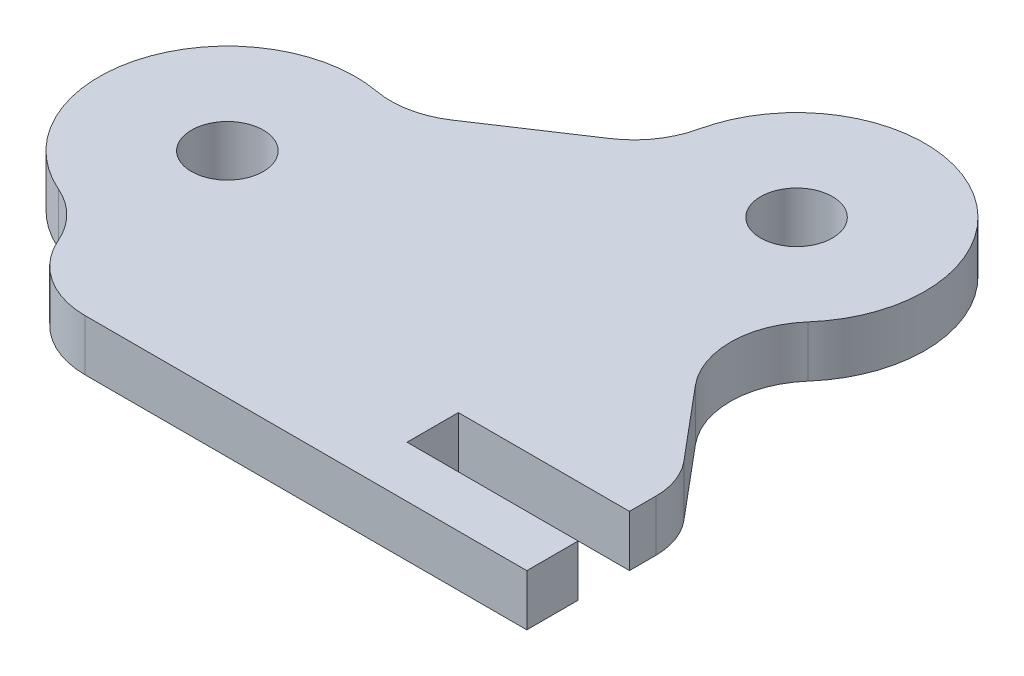
from build123d import *

# Parameters (mm, degrees)
SKETCH1_R           = 2.1
BOSS_EXTRUDE1_DEPTH = 3
FILLET1_R           = 5
SKETCH2_W           = 10
SKETCH2_H           = 3
CUT_EXTRUDE1_DEPTH  = 3


with BuildPart() as part:
    # Sketch1 → Boss-Extrude1 (new body)
    with BuildSketch(Plane(origin=(0, 0, 0), x_dir=(1, 0, 0), z_dir=(0, 1, 0))):
        with BuildLine():
            Line((0, -11.456439237), (0, -12.5))
            Line((0, -12.5), (30, -12.5))
            Line((30, -12.5), (30, -4.955880937))
            ThreePointArc((30, -4.955880937), (29.758770483, -3.587800364), (29.064177772, -2.384730498))
            Line((29.064177772, -2.384730498), (25.555494336, 1.796755592))
            ThreePointArc((25.555494336, 1.796755592), (24.386056013, 5.068955923), (25.631429931, 8.313015849))
            ThreePointArc((25.631429931, 8.313015849), (23.39515563, 19.95401875), (12.677699795, 14.889434685))
            ThreePointArc((12.677699795, 14.889434685), (11.918282987, 13.141523465), (10.560020318, 11.804725034))
            Line((10.560020318, 11.804725034), (5.017813295, 8.128440794))
            ThreePointArc((5.017813295, 8.128440794), (3.258028142, 7.396960283), (1.352375582, 7.377064476))
            ThreePointArc((1.352375582, 7.377064476), (-7.172928544, 2.190683933), (-3, -6.873863542))
            ThreePointArc((-3, -6.873863542), (-0.816699867, -8.71782645), (0, -11.456439237))
        make_face()
        with Locations(Location((0, 0, 0), (0, 0, 270))):
            Circle(SKETCH1_R, mode=Mode.SUBTRACT)
        with Locations(Location((20, 13.266499161, 0), (0, 0, 270))):
            Circle(SKETCH1_R, mode=Mode.SUBTRACT)
    extrude(amount=BOSS_EXTRUDE1_DEPTH)

    # Fillet1
    fillet1_edges = [part.edges().sort_by_distance(p)[0] for p in [
        (0, 1.5, 12.5),
    ]]
    fillet(fillet1_edges, radius=FILLET1_R)

    # Sketch2 → Cut-Extrude1 (cut)
    with BuildSketch(Plane(origin=(0, 3, 0), x_dir=(1, 0, 0), z_dir=(0, 1, 0))):
        with Locations((25, -8)):
            Rectangle(SKETCH2_W, SKETCH2_H)
    extrude(amount=-CUT_EXTRUDE1_DEPTH, mode=Mode.SUBTRACT)


solid = part.part
